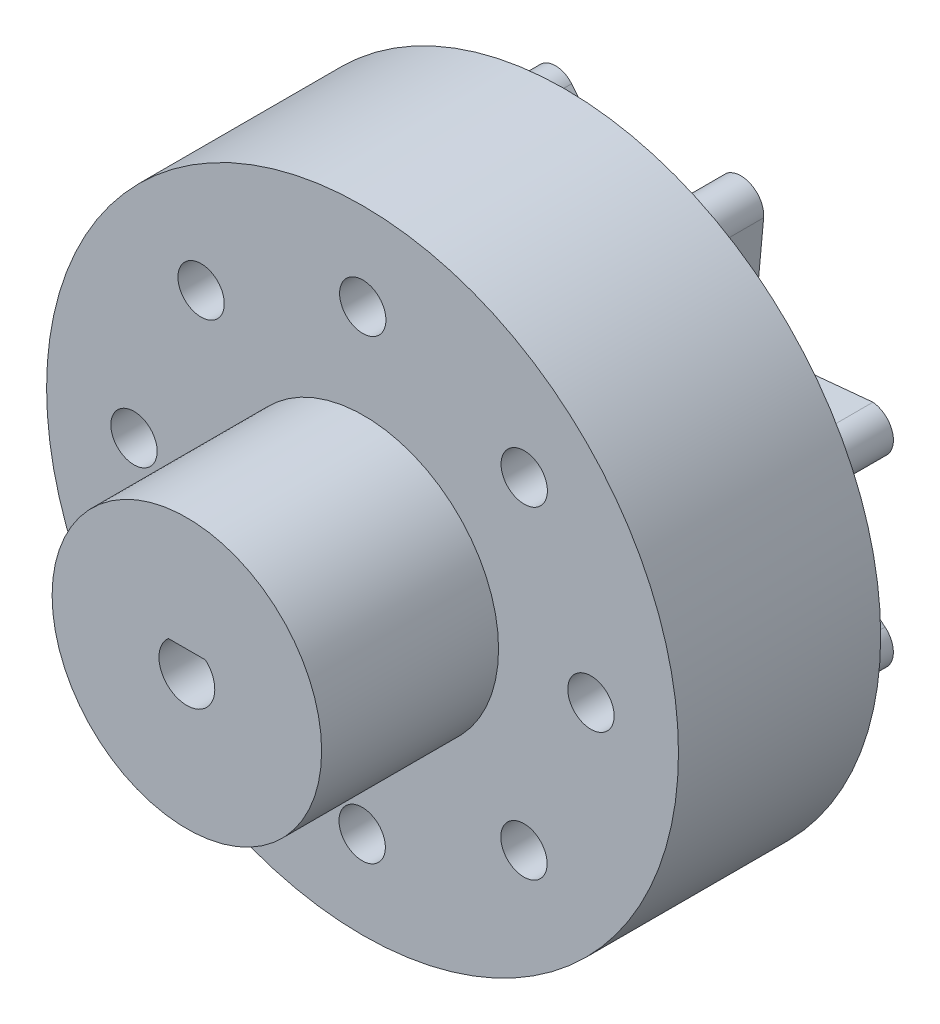
from build123d import *

# Parameters (mm, degrees)
CROQUIS1_R              = 75
CROQUIS1_R_2            = 5.5
SALIENTE_EXTRUIR2_DEPTH = 90
SALIENTE_EXTRUIR3_DEPTH = 20
CROQUIS3_R              = 12.677450178
CORTAR_EXTRUIR1_DEPTH   = 110
CROQUIS7_R              = 86.720907706
CROQUIS7_R_2            = 31.991589163
CORTAR_EXTRUIR6_DEPTH   = 42
SALIENTE_EXTRUIR5_START = -40
CROQUIS8_R              = 12.677450178
SALIENTE_EXTRUIR5_DEPTH = 40


with BuildPart() as part:
    # Croquis1 → Saliente-Extruir2 (new body)
    with BuildSketch(Plane.XY):
        with Locations(Location((-0.300298633, -0.001591846, 0), (0, 0, 180))):
            Circle(CROQUIS1_R)
        with Locations(Location((38.084343476, 38.301334696, 0), (0, 0, 180))):
            Circle(CROQUIS1_R_2, mode=Mode.SUBTRACT)
        with Locations(Location((53.921710963, -0.069731009, 0), (0, 0, 180))):
            Circle(CROQUIS1_R_2, mode=Mode.SUBTRACT)
        with Locations(Location((38.017275671, -38.400881717, 0), (0, 0, 180))):
            Circle(CROQUIS1_R_2, mode=Mode.SUBTRACT)
        with Locations(Location((-0.383085558, -54.238249204, 0), (0, 0, 180))):
            Circle(CROQUIS1_R_2, mode=Mode.SUBTRACT)
        with Locations(Location((-38.714236265, -38.304518389, 0), (0, 0, 180))):
            Circle(CROQUIS1_R_2, mode=Mode.SUBTRACT)
        with Locations(Location((-54.551603752, 0.066547317, 0), (0, 0, 180))):
            Circle(CROQUIS1_R_2, mode=Mode.SUBTRACT)
        with Locations(Location((-38.617872937, 38.397698024, 0), (0, 0, 180))):
            Circle(CROQUIS1_R_2, mode=Mode.SUBTRACT)
        with Locations(Location((-0.246807232, 54.235065511, 0), (0, 0, 180))):
            Circle(CROQUIS1_R_2, mode=Mode.SUBTRACT)
    extrude(amount=SALIENTE_EXTRUIR2_DEPTH)

    # Croquis2 → Saliente-Extruir3 (add)
    with BuildSketch(Plane(origin=(0, 0, 0), x_dir=(-1, 0, 0), z_dir=(0, 0, -1))):
        with BuildLine():
            Line((26.112208604, 38.727030057), (27.485456967, 53.179425602))
            ThreePointArc((27.485456967, 53.179425602), (24.429171845, 58.268515598), (18.664650888, 56.850766019))
            Line((18.664650888, 56.850766019), (9.322520199, 45.625098372))
            ThreePointArc((9.322520199, 45.625098372), (0.246807232, 41.725065511), (-8.828905735, 45.625098372))
            Line((-8.828905735, 45.625098372), (-18.077259399, 56.815518496))
            ThreePointArc((-18.077259399, 56.815518496), (-24.061995546, 57.38682812), (-26.914903807, 52.094912031))
            Line((-26.914903807, 52.094912031), (-25.583042051, 37.551282353))
            ThreePointArc((-25.583042051, 37.551282353), (-29.618728772, 29.072115687), (-38.414038327, 25.78189313))
            Line((-38.414038327, 25.78189313), (-52.866433872, 27.155141493))
            ThreePointArc((-52.866433872, 27.155141493), (-57.489082017, 23.336218016), (-55.768515975, 17.592290361))
            Line((-55.768515975, 17.592290361), (-45.299902018, 9.018464332))
            ThreePointArc((-45.299902018, 9.018464332), (-41.406181734, 0.471020463), (-44.548158548, -8.380410835))
            Line((-44.548158548, -8.380410835), (-55.738578672, -17.628764499))
            ThreePointArc((-55.738578672, -17.628764499), (-57.481280164, -23.378316923), (-52.860896821, -27.218423606))
            Line((-52.860896821, -27.218423606), (-37.951986277, -25.85311053))
            ThreePointArc((-37.951986277, -25.85311053), (-29.390923032, -29.288425153), (-25.491911386, -37.648502822))
            Line((-25.491911386, -37.648502822), (-26.86515975, -52.100898367))
            ThreePointArc((-26.86515975, -52.100898367), (-24.027008592, -57.407327586), (-18.034758099, -56.853949712))
            Line((-18.034758099, -56.853949712), (-8.692627409, -45.628282064))
            ThreePointArc((-8.692627409, -45.628282064), (0.383085558, -41.728249204), (9.458798525, -45.628282064))
            Line((9.458798525, -45.628282064), (18.707152189, -56.818702189))
            ThreePointArc((18.707152189, -56.818702189), (24.46680217, -58.2561123), (27.540433688, -53.177480099))
            Line((27.540433688, -53.177480099), (26.208571932, -38.633850421))
            ThreePointArc((26.208571932, -38.633850421), (29.868330432, -29.458612556), (39.043568298, -25.798854055))
            Line((39.043568298, -25.798854055), (53.495963843, -27.172102419))
            ThreePointArc((53.495963843, -27.172102419), (58.58505384, -24.115817297), (57.16730426, -18.35129634))
            Line((57.16730426, -18.35129634), (45.941636613, -9.00916565))
            ThreePointArc((45.941636613, -9.00916565), (42.041603752, 0.066547317), (45.941636613, 9.142260284))
            Line((45.941636613, 9.142260284), (57.132056737, 18.390613948))
            ThreePointArc((57.132056737, 18.390613948), (58.569466849, 24.150263929), (53.490834648, 27.223895446))
            Line((53.490834648, 27.223895446), (38.94720497, 25.892033691))
            ThreePointArc((38.94720497, 25.892033691), (29.771967104, 29.551792191), (26.112208604, 38.727030057))
        make_face()
    extrude(amount=SALIENTE_EXTRUIR3_DEPTH)

    # Croquis3 → Cortar-Extruir1 (cut)
    with BuildSketch(Plane(origin=(0, 0, -20), x_dir=(-1, 0, 0), z_dir=(0, 0, -1))):
        Circle(CROQUIS3_R)
    extrude(amount=-CORTAR_EXTRUIR1_DEPTH, mode=Mode.SUBTRACT)

    # Croquis7 → Cortar-Extruir6 (cut)
    with BuildSketch(Plane.XY.offset(90)):
        Circle(CROQUIS7_R)
        Circle(CROQUIS7_R_2, mode=Mode.SUBTRACT)
    extrude(amount=-CORTAR_EXTRUIR6_DEPTH, mode=Mode.SUBTRACT)

    # Croquis8 → Saliente-Extruir5 (add)
    with BuildSketch(Plane.XY.offset(90).offset(SALIENTE_EXTRUIR5_START)):
        with Locations(Location((0, 0, 0), (0, 0, 180))):
            Circle(CROQUIS8_R)
        with BuildLine():
            Line((4.407319519, 4.947589036), (-4.407319519, 4.947589036))
            ThreePointArc((-4.407319519, 4.947589036), (0, -6.62594164), (4.407319519, 4.947589036))
        make_face(mode=Mode.SUBTRACT)
    extrude(amount=SALIENTE_EXTRUIR5_DEPTH)


solid = part.part
